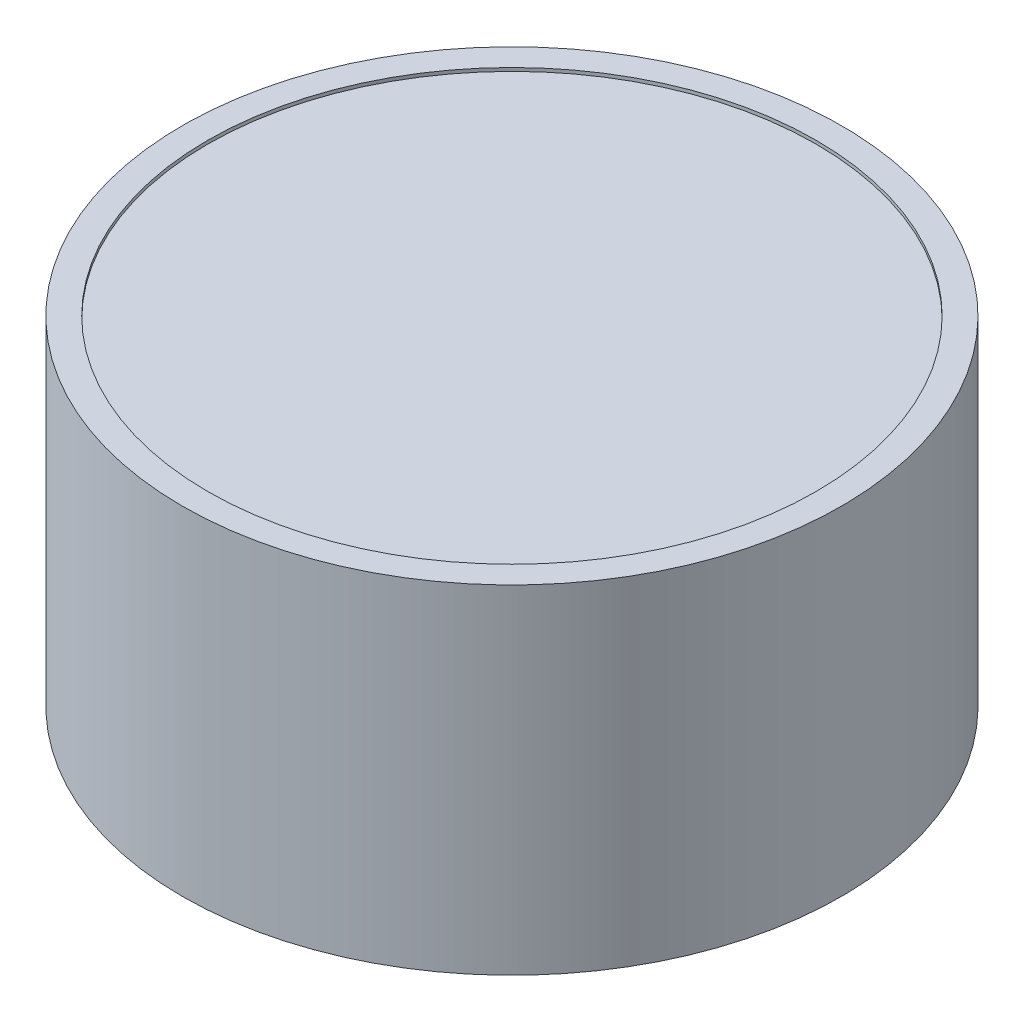
from build123d import *

# Parameters (mm, degrees)
SKETCH2_R           = 4.875
BOSS_EXTRUDE1_DEPTH = 5
SKETCH3_R           = 4.5
CUT_EXTRUDE1_DEPTH  = 1
BOSS_EXTRUDE2_START = 0.95
SKETCH4_R           = 4.5
BOSS_EXTRUDE2_DEPTH = 0.95


with BuildPart() as part:
    # Sketch2 → Boss-Extrude1 (new body)
    with BuildSketch(Plane(origin=(0, 0, 0), x_dir=(1, 0, 0), z_dir=(0, 1, 0))):
        with Locations(Location((0, 0, 0), (0, 0, 270))):
            Circle(SKETCH2_R)
    extrude(amount=BOSS_EXTRUDE1_DEPTH)

    # Sketch3 → Cut-Extrude1 (cut)
    with BuildSketch(Plane(origin=(0, 5, 0), x_dir=(1, 0, 0), z_dir=(0, 1, 0))):
        with Locations(Location((0, 0, 0), (0, 0, 270))):
            Circle(SKETCH3_R)
    extrude(amount=-CUT_EXTRUDE1_DEPTH, mode=Mode.SUBTRACT)

    # Sketch4 → Boss-Extrude2 (add)
    with BuildSketch(Plane(origin=(0, 4, 0), x_dir=(1, 0, 0), z_dir=(0, 1, 0)).offset(BOSS_EXTRUDE2_START)):
        with Locations(Location((0, 0, 0), (0, 0, 270))):
            Circle(SKETCH4_R)
    extrude(amount=-BOSS_EXTRUDE2_DEPTH)


solid = part.part
